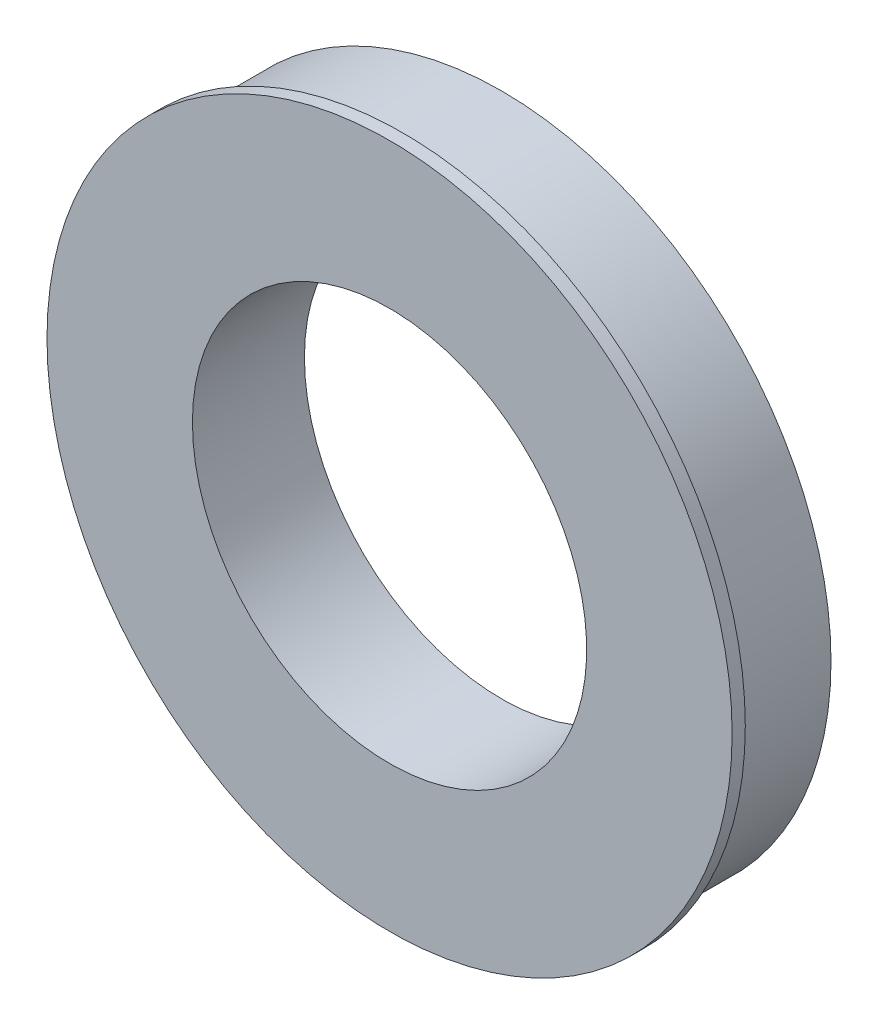
from build123d import *

# Parameters (mm, degrees)
SKETCH1_R           = 63.5
SKETCH1_R_2         = 38
BOSS_EXTRUDE1_DEPTH = 19.05
SKETCH3_R           = 66.03
SKETCH3_R_2         = 38
BOSS_EXTRUDE2_DEPTH = 2.54


with BuildPart() as part:
    # Sketch1 → Boss-Extrude1 (new body)
    with BuildSketch(Plane.XY):
        with Locations(Location((0, 0, 0), (0, 0, 180))):
            Circle(SKETCH1_R)
        with Locations(Location((0, 0, 0), (0, 0, 180))):
            Circle(SKETCH1_R_2, mode=Mode.SUBTRACT)
    extrude(amount=BOSS_EXTRUDE1_DEPTH)

    # Sketch3 → Boss-Extrude2 (add)
    with BuildSketch(Plane.XY.offset(19.05)):
        Circle(SKETCH3_R)
        with Locations(Location((0, 0, 0), (0, 0, 180))):
            Circle(SKETCH3_R_2, mode=Mode.SUBTRACT)
    extrude(amount=BOSS_EXTRUDE2_DEPTH)


solid = part.part
